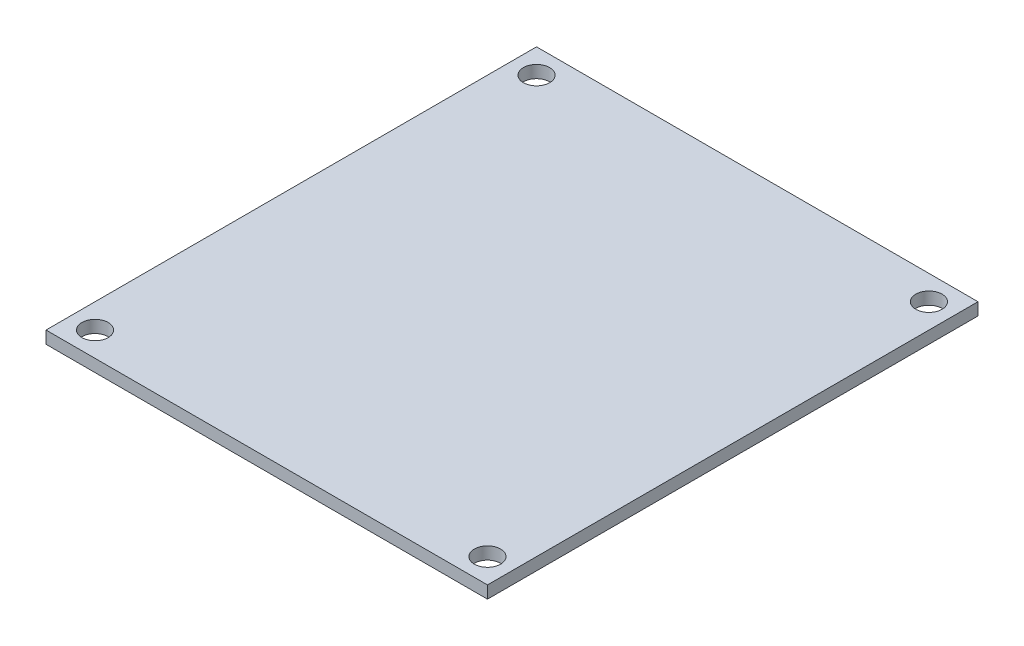
from build123d import *

# Parameters (mm, degrees)
SKETCH1_W                = 57.15
SKETCH1_H                = 63.5
BOSS_EXTRUDE1_DEPTH      = 1.6
M3_CLEARANCE_HOLE1_D     = 3.4
M3_CLEARANCE_HOLE1_DEPTH = 50
M3_CLEARANCE_HOLE1_TIP   = 1.021463052


with BuildPart() as part:
    # Sketch1 → Boss-Extrude1 (new body)
    with BuildSketch(Plane(origin=(0, 0, 0), x_dir=(1, 0, 0), z_dir=(0, 1, 0))):
        Rectangle(SKETCH1_W, SKETCH1_H)
    extrude(amount=BOSS_EXTRUDE1_DEPTH)

    # M3 Clearance Hole1
    with Locations(Plane(origin=(0, 1.6, 0), x_dir=(1, 0, 0), z_dir=(0, 1, 0))):
        with Locations((-25.4, 28.575), (25.4, 28.575), (25.4, -28.575), (-25.4, -28.575)):
            Hole(M3_CLEARANCE_HOLE1_D / 2, depth=M3_CLEARANCE_HOLE1_DEPTH)
            with Locations((0, 0, -(M3_CLEARANCE_HOLE1_DEPTH + M3_CLEARANCE_HOLE1_TIP / 2))):  # 118° drill point
                Cone(0, M3_CLEARANCE_HOLE1_D / 2, M3_CLEARANCE_HOLE1_TIP, mode=Mode.SUBTRACT)


solid = part.part
